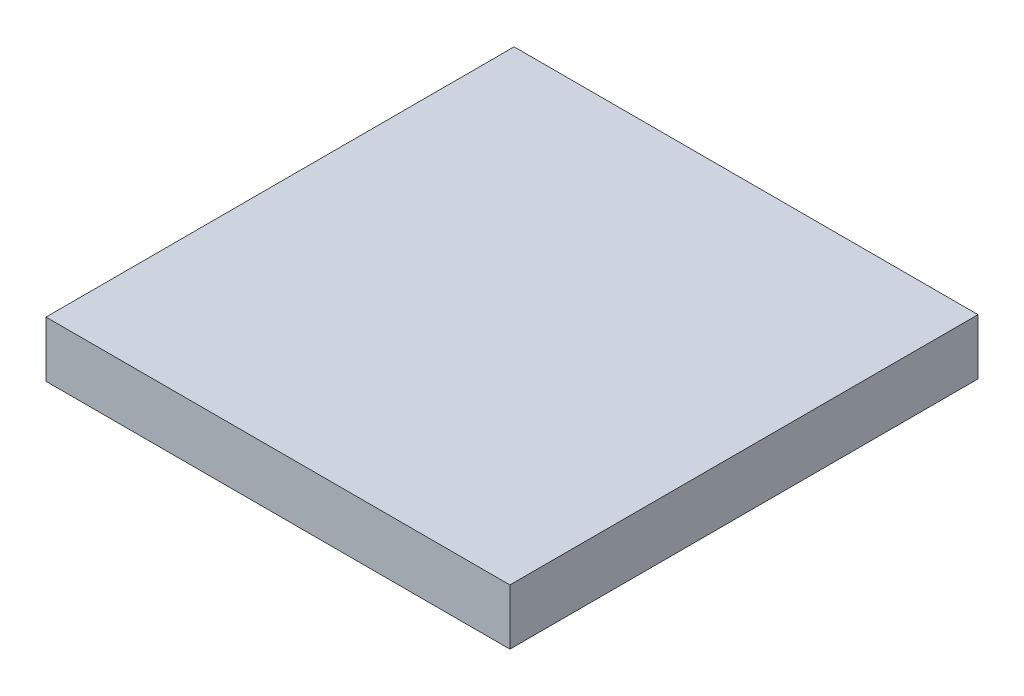
from build123d import *

# Parameters (mm, degrees)
SKETCH_1_W                  = 25
SKETCH_1_H                  = 25.22650516
EXTRUDE_1_DEPTH             = 3
SKETCH_1_3_R                = 2.5
CUT_EXTRUDE_1_DEPTH         = 2
PATTERN_LINEAR_1_COUNT      = 3
PATTERN_LINEAR_1_PITCH      = 7.5
PATTERN_LINEAR_1_COUNT_DIR2 = 3
PATTERN_LINEAR_1_PITCH_DIR2 = 7.5
SKETCH_1_4_R                = 1.5
CUT_EXTRUDE_2_DEPTH         = 2.5
PATTERN_LINEAR_2_COUNT      = 3
PATTERN_LINEAR_2_PITCH      = 7.5
PATTERN_LINEAR_2_COUNT_DIR2 = 3
PATTERN_LINEAR_2_PITCH_DIR2 = 7.5


with BuildPart() as part:
    # 草图1 → 凸台-拉伸1 (new body)
    with BuildSketch(Plane(origin=(0, 0, 0), x_dir=(1, 0, 0), z_dir=(0, 1, 0))):
        with Locations((7.5, -7.38674742)):
            Rectangle(SKETCH_1_W, SKETCH_1_H)
    extrude(amount=EXTRUDE_1_DEPTH)

    # 草图1<3> → 切除-拉伸1 (cut)
    with BuildSketch(Plane(origin=(0, 0, 0), x_dir=(1, 0, 0), z_dir=(0, 1, 0))):
        with Locations((15, -14.77349484)):
            Circle(SKETCH_1_3_R)
    cut_extrude_1 = extrude(amount=CUT_EXTRUDE_1_DEPTH, mode=Mode.SUBTRACT)

    # 阵列(线性)1: Cut-Extrude 1 3 × 3
    with Locations(*[(-j * PATTERN_LINEAR_1_PITCH_DIR2, 0, -i * PATTERN_LINEAR_1_PITCH) for i in range(PATTERN_LINEAR_1_COUNT) for j in range(PATTERN_LINEAR_1_COUNT_DIR2) if (i, j) != (0, 0)]):
        add(cut_extrude_1, mode=Mode.SUBTRACT)

    # 草图1<4> → 切除-拉伸2 (cut)
    with BuildSketch(Plane(origin=(0, 0, 0), x_dir=(1, 0, 0), z_dir=(0, 1, 0))):
        with Locations((15, -14.77349484)):
            Circle(SKETCH_1_4_R)
    cut_extrude_2 = extrude(amount=CUT_EXTRUDE_2_DEPTH, mode=Mode.SUBTRACT)

    # 阵列(线性)2: Cut-Extrude 2 3 × 3
    with Locations(*[(-j * PATTERN_LINEAR_2_PITCH_DIR2, 0, -i * PATTERN_LINEAR_2_PITCH) for i in range(PATTERN_LINEAR_2_COUNT) for j in range(PATTERN_LINEAR_2_COUNT_DIR2) if (i, j) != (0, 0)]):
        add(cut_extrude_2, mode=Mode.SUBTRACT)


solid = part.part
